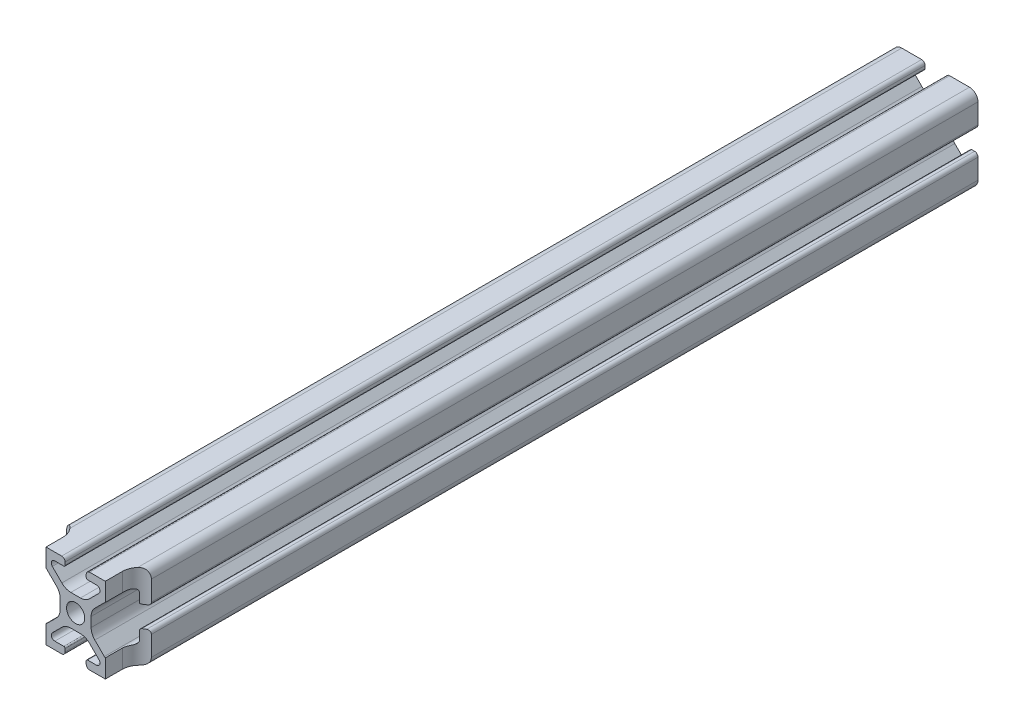
from build123d import *

# Parameters (mm, degrees)
ESQUISSE1_R             = 2.15
BOSS_EXTRU_1_DEPTH      = 203
ENL_V_MAT_EXTRU_1_DEPTH = 205.960971895


with BuildPart() as part:
    # Esquisse1 → Boss.-Extru.1 (new body)
    with BuildSketch(Plane(origin=(0, 0, 0), x_dir=(-1, 0, 0), z_dir=(0, 0, -1))):
        with BuildLine():
            Line((-12.499999997, 0.800000003), (-12.499999998, 1.500000003))
            ThreePointArc((-12.499999998, 1.500000003), (-12.587867964, 1.712132039), (-12.8, 1.800000005))
            Line((-12.8, 1.800000005), (-14.9175884, 1.800000005))
            ThreePointArc((-14.9175884, 1.800000005), (-15.686636444, 2.31386148), (-15.50619229, 3.2210155))
            Line((-15.50619229, 3.2210155), (-13.25588745, 5.47132034))
            ThreePointArc((-13.25588745, 5.47132034), (-12.282617404, 6.121638593), (-11.134567108, 6.349999996))
            Line((-11.134567108, 6.349999996), (-8.865432907, 6.349999996))
            ThreePointArc((-8.865432907, 6.349999996), (-7.717382611, 6.121638594), (-6.744112567, 5.471320341))
            Line((-6.744112567, 5.471320341), (-4.493807729, 3.221015503))
            ThreePointArc((-4.493807729, 3.221015503), (-4.313363575, 2.313861481), (-5.082411621, 1.800000005))
            Line((-5.082411621, 1.800000005), (-7.20000001, 1.800000005))
            ThreePointArc((-7.20000001, 1.800000005), (-7.412132045, 1.71213204), (-7.50000001, 1.500000005))
            Line((-7.50000001, 1.500000005), (-7.50000001, 0.8))
            ThreePointArc((-7.50000001, 0.8), (-7.265685435, 0.234314575), (-6.70000001, 0))
            Line((-6.70000001, 0), (-2, 0))
            ThreePointArc((-2, 0), (-0.585786438, 0.585786438), (0, 2))
            Line((0, 2), (0, 6.699999998))
            ThreePointArc((0, 6.699999998), (-0.234314576, 7.265685424), (-0.800000003, 7.5))
            Line((-0.800000003, 7.5), (-1.50000001, 7.5))
            ThreePointArc((-1.50000001, 7.5), (-1.712132046, 7.412132033), (-1.800000013, 7.199999997))
            Line((-1.800000013, 7.199999997), (-1.800000013, 5.082411603))
            ThreePointArc((-1.800000013, 5.082411603), (-2.313861487, 4.31336356), (-3.221015507, 4.493807713))
            Line((-3.221015507, 4.493807713), (-5.471320347, 6.744112553))
            ThreePointArc((-5.471320347, 6.744112553), (-6.1216386, 7.717382599), (-6.350000003, 8.865432896))
            Line((-6.350000003, 8.865432896), (-6.350000003, 11.134567102))
            ThreePointArc((-6.350000003, 11.134567102), (-6.121638601, 12.282617397), (-5.471320348, 13.255887442))
            Line((-5.471320348, 13.255887442), (-3.221015512, 15.506192278))
            ThreePointArc((-3.221015512, 15.506192278), (-2.313861489, 15.686636432), (-1.800000013, 14.917588386))
            Line((-1.800000013, 14.917588386), (-1.800000013, 12.799999998))
            ThreePointArc((-1.800000013, 12.799999998), (-1.712132047, 12.587867963), (-1.500000013, 12.499999997))
            Line((-1.500000013, 12.499999997), (-0.8, 12.499999997))
            ThreePointArc((-0.8, 12.499999997), (-0.234314575, 12.734314573), (0, 13.299999998))
            Line((0, 13.299999998), (0, 18))
            ThreePointArc((0, 18), (-0.585786438, 19.414213562), (-2, 20))
            Line((-2, 20), (-6.700000008, 20))
            ThreePointArc((-6.700000008, 20), (-7.265685435, 19.765685424), (-7.50000001, 19.199999998))
            Line((-7.50000001, 19.199999998), (-7.50000001, 18.500000005))
            ThreePointArc((-7.50000001, 18.500000005), (-7.412132044, 18.287867969), (-7.200000008, 18.200000003))
            Line((-7.200000008, 18.200000003), (-5.082411594, 18.200000003))
            ThreePointArc((-5.082411594, 18.200000003), (-4.313363546, 17.686138526), (-4.493807701, 16.778984501))
            Line((-4.493807701, 16.778984501), (-6.744112542, 14.528679659))
            ThreePointArc((-6.744112542, 14.528679659), (-7.717382588, 13.878361406), (-8.865432885, 13.650000003))
            Line((-8.865432885, 13.650000003), (-11.134567112, 13.650000003))
            ThreePointArc((-11.134567112, 13.650000003), (-12.282617407, 13.878361405), (-13.255887452, 14.528679658))
            Line((-13.255887452, 14.528679658), (-15.506192292, 16.778984498))
            ThreePointArc((-15.506192292, 16.778984498), (-15.686636447, 17.686138525), (-14.917588397, 18.200000002))
            Line((-14.917588397, 18.200000002), (-12.799999998, 18.200000003))
            ThreePointArc((-12.799999998, 18.200000003), (-12.587867963, 18.287867968), (-12.499999997, 18.500000002))
            Line((-12.499999997, 18.500000002), (-12.499999997, 19.2))
            ThreePointArc((-12.499999997, 19.2), (-12.734314573, 19.765685425), (-13.299999998, 20))
            Line((-13.299999998, 20), (-18, 20))
            ThreePointArc((-18, 20), (-19.414213562, 19.414213562), (-20, 18))
            Line((-20, 18), (-20, 13.3))
            ThreePointArc((-20, 13.3), (-19.765685424, 12.734314573), (-19.199999998, 12.499999997))
            Line((-19.199999998, 12.499999997), (-18.500000003, 12.499999997))
            ThreePointArc((-18.500000003, 12.499999997), (-18.287867967, 12.587867964), (-18.2, 12.8))
            Line((-18.2, 12.8), (-18.2, 14.91758839))
            ThreePointArc((-18.2, 14.91758839), (-17.686138526, 15.686636434), (-16.778984506, 15.50619228))
            Line((-16.778984506, 15.50619228), (-14.528679657, 13.255887431))
            ThreePointArc((-14.528679657, 13.255887431), (-13.878361403, 12.282617385), (-13.650000001, 11.134567088))
            Line((-13.650000001, 11.134567088), (-13.650000001, 8.865432886))
            ThreePointArc((-13.650000001, 8.865432886), (-13.878361403, 7.717382591), (-14.528679656, 6.744112546))
            Line((-14.528679656, 6.744112546), (-16.778984496, 4.493807706))
            ThreePointArc((-16.778984496, 4.493807706), (-17.686138522, 4.313363551), (-18.2, 5.0824116))
            Line((-18.2, 5.0824116), (-18.2, 7.2))
            ThreePointArc((-18.2, 7.2), (-18.287867966, 7.412132034), (-18.5, 7.5))
            Line((-18.5, 7.5), (-19.2, 7.5))
            ThreePointArc((-19.2, 7.5), (-19.765685425, 7.265685425), (-20, 6.7))
            Line((-20, 6.7), (-20, 2))
            ThreePointArc((-20, 2), (-19.414213562, 0.585786438), (-18, 0))
            Line((-18, 0), (-13.3, 0))
            ThreePointArc((-13.3, 0), (-12.734314573, 0.234314576), (-12.499999997, 0.800000003))
        make_face()
        with Locations((-10, 10)):
            Circle(ESQUISSE1_R, mode=Mode.SUBTRACT)
    extrude(amount=-BOSS_EXTRU_1_DEPTH)

    # Esquisse2 → Enlèv. mat.-Extru.1 (cut, through all)
    with BuildSketch(Plane(origin=(0, 20, 0), x_dir=(1, 0, 0), z_dir=(0, 1, 0))):
        with BuildLine():
            Line((25, -199), (25, -209))
            ThreePointArc((25, -209), (21, -213), (17, -209))
            Line((17, -209), (17, -199))
            ThreePointArc((17, -199), (21, -195), (25, -199))
        make_face()
        with BuildLine():
            Line((-5.000000003, -199), (-5.000000003, -209))
            ThreePointArc((-5.000000003, -209), (-1.000000003, -213), (2.999999997, -209))
            Line((2.999999997, -209), (2.999999997, -199))
            ThreePointArc((2.999999997, -199), (-1.000000003, -195), (-5.000000003, -199))
        make_face()
    extrude(amount=-ENL_V_MAT_EXTRU_1_DEPTH, mode=Mode.SUBTRACT)


solid = part.part
